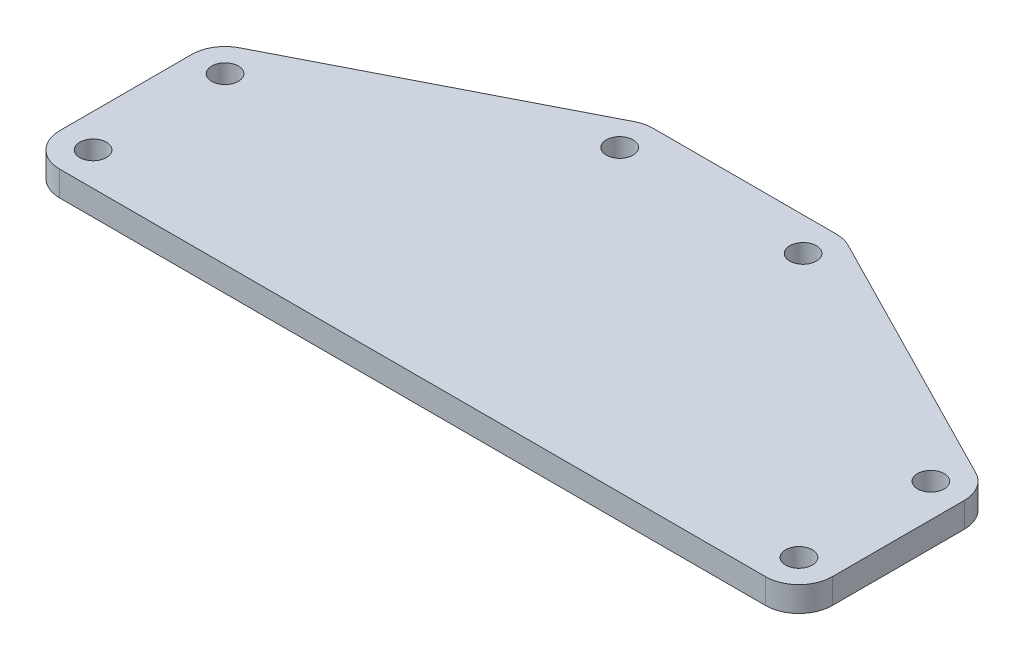
from build123d import *

# Parameters (mm, degrees)
SKETCH1_R           = 1.6
BOSS_EXTRUDE1_DEPTH = 3


with BuildPart() as part:
    # Sketch1 → Boss-Extrude1 (new body)
    with BuildSketch(Plane(origin=(0, 0, 0), x_dir=(1, 0, 0), z_dir=(0, 1, 0))):
        with BuildLine():
            Line((-46.325, -31.824989817), (-46.325, -15.999989817))
            ThreePointArc((-46.325, -15.999989817), (-45.736595381, -13.911685012), (-44.144491522, -12.437764304))
            Line((-44.144491522, -12.437764304), (-12.819491522, 3.562225512))
            ThreePointArc((-12.819491522, 3.562225512), (-11.93570774, 3.889016717), (-11, 4))
            Line((-11, 4), (11, 4))
            ThreePointArc((11, 4), (11.93570774, 3.889016717), (12.819491522, 3.562225512))
            Line((12.819491522, 3.562225512), (44.144491522, -12.437764304))
            ThreePointArc((44.144491522, -12.437764304), (45.736595381, -13.911685012), (46.325, -15.999989817))
            Line((46.325, -15.999989817), (46.325, -31.824989817))
            ThreePointArc((46.325, -31.824989817), (45.153427125, -34.653416941), (42.325, -35.824989817))
            Line((42.325, -35.824989817), (-42.325, -35.824989817))
            ThreePointArc((-42.325, -35.824989817), (-45.153427125, -34.653416941), (-46.325, -31.824989817))
        make_face()
        with Locations(Location((-42.325, -31.824989817, 0), (0, 0, 270))):
            Circle(SKETCH1_R, mode=Mode.SUBTRACT)
        with Locations(Location((-42.325, -15.999989817, 0), (0, 0, 270))):
            Circle(SKETCH1_R, mode=Mode.SUBTRACT)
        with Locations(Location((42.325, -31.824989817, 0), (0, 0, 90))):
            Circle(SKETCH1_R, mode=Mode.SUBTRACT)
        with Locations(Location((42.325, -15.999989817, 0), (0, 0, 90))):
            Circle(SKETCH1_R, mode=Mode.SUBTRACT)
        with Locations(Location((-11, 0, 0), (0, 0, 270))):
            Circle(SKETCH1_R, mode=Mode.SUBTRACT)
        with Locations(Location((11, 0, 0), (0, 0, 270))):
            Circle(SKETCH1_R, mode=Mode.SUBTRACT)
    extrude(amount=BOSS_EXTRUDE1_DEPTH)


solid = part.part
